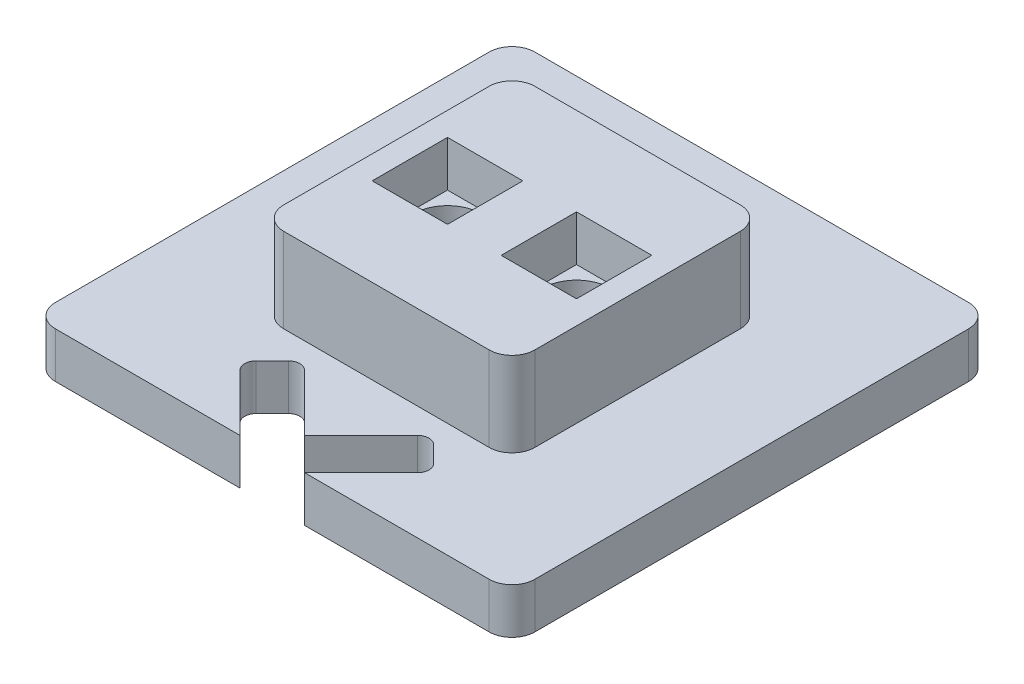
from build123d import *

# Parameters (mm, degrees)
SKETCH1_W           = 11
SKETCH1_H           = 11
BOSS_EXTRUDE1_DEPTH = 3.7
FILLET1_R           = 1
SKETCH2_W           = 3.3
SKETCH2_H           = 3.3
CUT_EXTRUDE1_DEPTH  = 2
SKETCH4_R           = 2.2
BOSS_EXTRUDE2_DEPTH = 2
BOSS_EXTRUDE3_DEPTH = 2
SKETCH3_R           = 1.5
CUT_EXTRUDE2_DEPTH  = 16.90565937
CUT_EXTRUDE3_DEPTH  = 16.303267625


with BuildPart() as part:
    # Sketch1 → Boss-Extrude1 (new body)
    with BuildSketch(Plane(origin=(0, 0, 0), x_dir=(1, 0, 0), z_dir=(0, 1, 0))):
        Rectangle(SKETCH1_W, SKETCH1_H)
    extrude(amount=BOSS_EXTRUDE1_DEPTH)

    # Fillet1
    fillet1_edges = [part.edges().sort_by_distance(p)[0] for p in [
        (5.5, 1.85, 5.5),
        (-5.5, 1.85, 5.5),
        (-5.5, 1.85, -5.5),
        (5.5, 1.85, -5.5),
    ]]
    fillet(fillet1_edges, radius=FILLET1_R)

    # Sketch2 → Cut-Extrude1 (cut)
    with BuildSketch(Plane(origin=(0, 3.7, 0), x_dir=(1, 0, 0), z_dir=(0, 1, 0))):
        with Locations((-2.825, 0)):
            Rectangle(SKETCH2_W, SKETCH2_H)
        with Locations((2.825, 0)):
            Rectangle(SKETCH2_W, SKETCH2_H)
    extrude(amount=-CUT_EXTRUDE1_DEPTH, mode=Mode.SUBTRACT)

    # Sketch4 → Boss-Extrude2 (add)
    with BuildSketch(Plane(origin=(0, 0, 0), x_dir=(-1, 0, 0), z_dir=(0, -1, 0))):
        with Locations(Location((2.825, 0, 0), (0, 0, 90))):
            Circle(SKETCH4_R)
        with Locations(Location((-2.825, 0, 0), (0, 0, 90))):
            Circle(SKETCH4_R)
    extrude(amount=BOSS_EXTRUDE2_DEPTH)

    # Sketch5 → Boss-Extrude3 (add)
    with BuildSketch(Plane(origin=(0, -2, 0), x_dir=(-1, 0, 0), z_dir=(0, -1, 0))):
        with BuildLine():
            Line((9.5, 10.5), (-9.5, 10.5))
            ThreePointArc((-9.5, 10.5), (-10.207106781, 10.207106781), (-10.5, 9.5))
            Line((-10.5, 9.5), (-10.5, -9.5))
            ThreePointArc((-10.5, -9.5), (-10.207106781, -10.207106781), (-9.5, -10.5))
            Line((-9.5, -10.5), (9.5, -10.5))
            ThreePointArc((9.5, -10.5), (10.207106781, -10.207106781), (10.5, -9.5))
            Line((10.5, -9.5), (10.5, 9.5))
            ThreePointArc((10.5, 9.5), (10.207106781, 10.207106781), (9.5, 10.5))
        make_face()
    extrude(amount=-BOSS_EXTRUDE3_DEPTH)

    # Sketch3 → Cut-Extrude2 (cut, through all)
    with BuildSketch(Plane(origin=(0, 3.7, 0), x_dir=(1, 0, 0), z_dir=(0, 1, 0))):
        with Locations(Location((-2.825, 0, 0), (0, 0, 270))):
            Circle(SKETCH3_R)
        with Locations(Location((2.825, 0, 0), (0, 0, 270))):
            Circle(SKETCH3_R)
    extrude(amount=-CUT_EXTRUDE2_DEPTH, mode=Mode.SUBTRACT)

    # Sketch7 → Cut-Extrude3 (cut, through all)
    with BuildSketch(Plane(origin=(0, 0, 0), x_dir=(1, 0, 0), z_dir=(0, 1, 0))):
        with BuildLine():
            Line((0, -9.085786438), (1.414213562, -10.5))
            Line((1.414213562, -10.5), (3.889087297, -8.025126266))
            ThreePointArc((3.889087297, -8.025126266), (4.035533906, -7.671572875), (3.889087297, -7.318019485))
            Line((3.889087297, -7.318019485), (3.181980515, -6.610912703))
            ThreePointArc((3.181980515, -6.610912703), (2.828427125, -6.464466094), (2.474873734, -6.610912703))
            Line((2.474873734, -6.610912703), (0, -9.085786438))
        make_face()
        with BuildLine():
            Line((-3.889087297, -8.025126266), (-1.414213562, -10.5))
            Line((-1.414213562, -10.5), (0, -9.085786438))
            Line((0, -9.085786438), (-2.474873734, -6.610912703))
            ThreePointArc((-2.474873734, -6.610912703), (-2.828427125, -6.464466094), (-3.181980515, -6.610912703))
            Line((-3.181980515, -6.610912703), (-3.889087297, -7.318019485))
            ThreePointArc((-3.889087297, -7.318019485), (-4.035533906, -7.671572875), (-3.889087297, -8.025126266))
        make_face()
        Polygon((-1.414213562, -10.5), (1.414213562, -10.5), (0, -9.085786438), align=None)
    extrude(amount=-CUT_EXTRUDE3_DEPTH, mode=Mode.SUBTRACT)


solid = part.part
